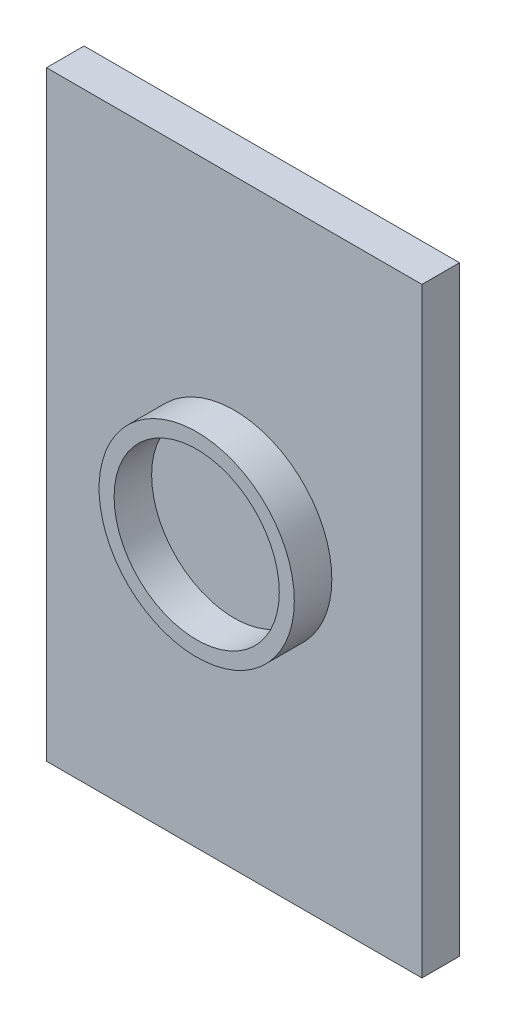
from build123d import *

# Parameters (mm, degrees)
SKETCH1_W           = 50
SKETCH1_H           = 80
BOSS_EXTRUDE2_DEPTH = 5
SKETCH2_R           = 13
SKETCH2_R_2         = 11
BOSS_EXTRUDE3_DEPTH = 5


with BuildPart() as part:
    # Sketch1 → Boss-Extrude2 (new body)
    with BuildSketch(Plane.XY):
        Rectangle(SKETCH1_W, SKETCH1_H)
    extrude(amount=BOSS_EXTRUDE2_DEPTH)

    # Sketch2 → Boss-Extrude3 (add)
    with BuildSketch(Plane.XY.offset(5)):
        Circle(SKETCH2_R)
        Circle(SKETCH2_R_2, mode=Mode.SUBTRACT)
    extrude(amount=BOSS_EXTRUDE3_DEPTH)


solid = part.part
